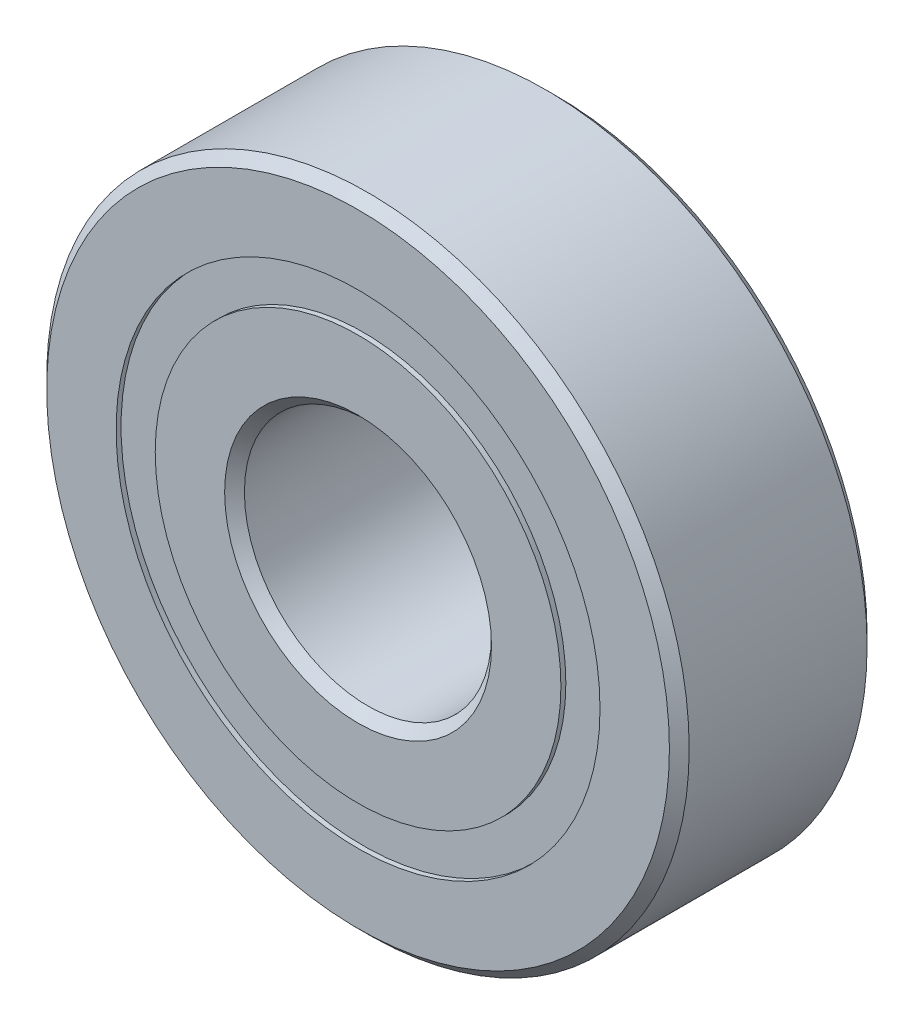
from build123d import *

# Parameters (mm, degrees)
CIRPATTERN1_COUNT = 14
SKETCH6_W         = 1.854105558
SKETCH6_H         = 1.582417582


with BuildPart() as part:
    # Sketch1 → Revolve1 (revolve)
    with BuildSketch(Plane(origin=(0, 0, 0), x_dir=(0, 0, -1), z_dir=(1, 0, 0))):
        with BuildLine():
            Line((3.6, 13), (-3.6, 13))
            Line((-3.6, 13), (-4, 12.6))
            Line((-4, 12.6), (-4, 9.791208791))
            Line((-4, 9.791208791), (-1.777777778, 9.791208791))
            ThreePointArc((-1.777777778, 9.791208791), (0, 10.945894442), (1.777777778, 9.791208791))
            Line((1.777777778, 9.791208791), (4, 9.791208791))
            Line((4, 9.791208791), (4, 12.6))
            Line((4, 12.6), (3.6, 13))
        make_face()
    revolve(axis=Axis((0, 0, 4), (0, 0, -1)))


with BuildPart() as body_2:
    # Sketch3 → Revolve3 (revolve)
    with BuildSketch(Plane(origin=(0, 0, 0), x_dir=(0, 0, -1), z_dir=(1, 0, 0))):
        with BuildLine():
            Line((-4, 8.208791209), (-1.777777778, 8.208791209))
            ThreePointArc((-1.777777778, 8.208791209), (0, 7.054105558), (1.777777778, 8.208791209))
            Line((1.777777778, 8.208791209), (4, 8.208791209))
            Line((4, 8.208791209), (4, 5.4))
            Line((4, 5.4), (3.6, 5))
            Line((3.6, 5), (-3.6, 5))
            Line((-3.6, 5), (-4, 5.4))
            Line((-4, 5.4), (-4, 8.208791209))
        make_face()
    revolve(axis=Axis((0, 0, 4), (0, 0, -1)))


with BuildPart() as body_3:
    # Sketch4 → Revolve4 (revolve)
    with BuildSketch(Plane(origin=(0, 0, 0), x_dir=(0, 0, -1), z_dir=(1, 0, 0))):
        with BuildLine():
            Line((-1.945894442, 9), (1.945894442, 9))
            ThreePointArc((1.945894442, 9), (0, 10.945894442), (-1.945894442, 9))
        make_face()
    revolve(axis=Axis((0, 9, 1.945894442), (0, 0, -1)))


with BuildPart() as cirpattern1_1:
    # CirPattern1: pattern copy
    add(body_3.part.rotate(Axis((0, 0, -4), (0, 0, 1)), 1 * 360 / CIRPATTERN1_COUNT))


with BuildPart() as cirpattern1_2:
    # CirPattern1: pattern copy
    add(body_3.part.rotate(Axis((0, 0, -4), (0, 0, 1)), 2 * 360 / CIRPATTERN1_COUNT))


with BuildPart() as cirpattern1_3:
    # CirPattern1: pattern copy
    add(body_3.part.rotate(Axis((0, 0, -4), (0, 0, 1)), 3 * 360 / CIRPATTERN1_COUNT))


with BuildPart() as cirpattern1_4:
    # CirPattern1: pattern copy
    add(body_3.part.rotate(Axis((0, 0, -4), (0, 0, 1)), 4 * 360 / CIRPATTERN1_COUNT))


with BuildPart() as cirpattern1_5:
    # CirPattern1: pattern copy
    add(body_3.part.rotate(Axis((0, 0, -4), (0, 0, 1)), 5 * 360 / CIRPATTERN1_COUNT))


with BuildPart() as cirpattern1_6:
    # CirPattern1: pattern copy
    add(body_3.part.rotate(Axis((0, 0, -4), (0, 0, 1)), 6 * 360 / CIRPATTERN1_COUNT))


with BuildPart() as cirpattern1_7:
    # CirPattern1: pattern copy
    add(body_3.part.rotate(Axis((0, 0, -4), (0, 0, 1)), 7 * 360 / CIRPATTERN1_COUNT))


with BuildPart() as cirpattern1_8:
    # CirPattern1: pattern copy
    add(body_3.part.rotate(Axis((0, 0, -4), (0, 0, 1)), 8 * 360 / CIRPATTERN1_COUNT))


with BuildPart() as cirpattern1_9:
    # CirPattern1: pattern copy
    add(body_3.part.rotate(Axis((0, 0, -4), (0, 0, 1)), 9 * 360 / CIRPATTERN1_COUNT))


with BuildPart() as cirpattern1_10:
    # CirPattern1: pattern copy
    add(body_3.part.rotate(Axis((0, 0, -4), (0, 0, 1)), 10 * 360 / CIRPATTERN1_COUNT))


with BuildPart() as cirpattern1_11:
    # CirPattern1: pattern copy
    add(body_3.part.rotate(Axis((0, 0, -4), (0, 0, 1)), 11 * 360 / CIRPATTERN1_COUNT))


with BuildPart() as cirpattern1_12:
    # CirPattern1: pattern copy
    add(body_3.part.rotate(Axis((0, 0, -4), (0, 0, 1)), 12 * 360 / CIRPATTERN1_COUNT))


with BuildPart() as cirpattern1_13:
    # CirPattern1: pattern copy
    add(body_3.part.rotate(Axis((0, 0, -4), (0, 0, 1)), 13 * 360 / CIRPATTERN1_COUNT))


with BuildPart() as body_17:
    # Sketch6 → Revolve5 (revolve)
    with BuildSketch(Plane(origin=(0, 0, 0), x_dir=(0, 0, -1), z_dir=(1, 0, 0))):
        with Locations((-2.872947221, 9)):
            Rectangle(SKETCH6_W, SKETCH6_H)
        with Locations((2.872947221, 9)):
            Rectangle(SKETCH6_W, SKETCH6_H)
    revolve(axis=Axis((0, 0, 4), (0, 0, -1)))


solid = Compound([part.part, body_2.part, body_3.part, cirpattern1_1.part, cirpattern1_2.part, cirpattern1_3.part, cirpattern1_4.part, cirpattern1_5.part, cirpattern1_6.part, cirpattern1_7.part, cirpattern1_8.part, cirpattern1_9.part, cirpattern1_10.part, cirpattern1_11.part, cirpattern1_12.part, cirpattern1_13.part, body_17.part])
